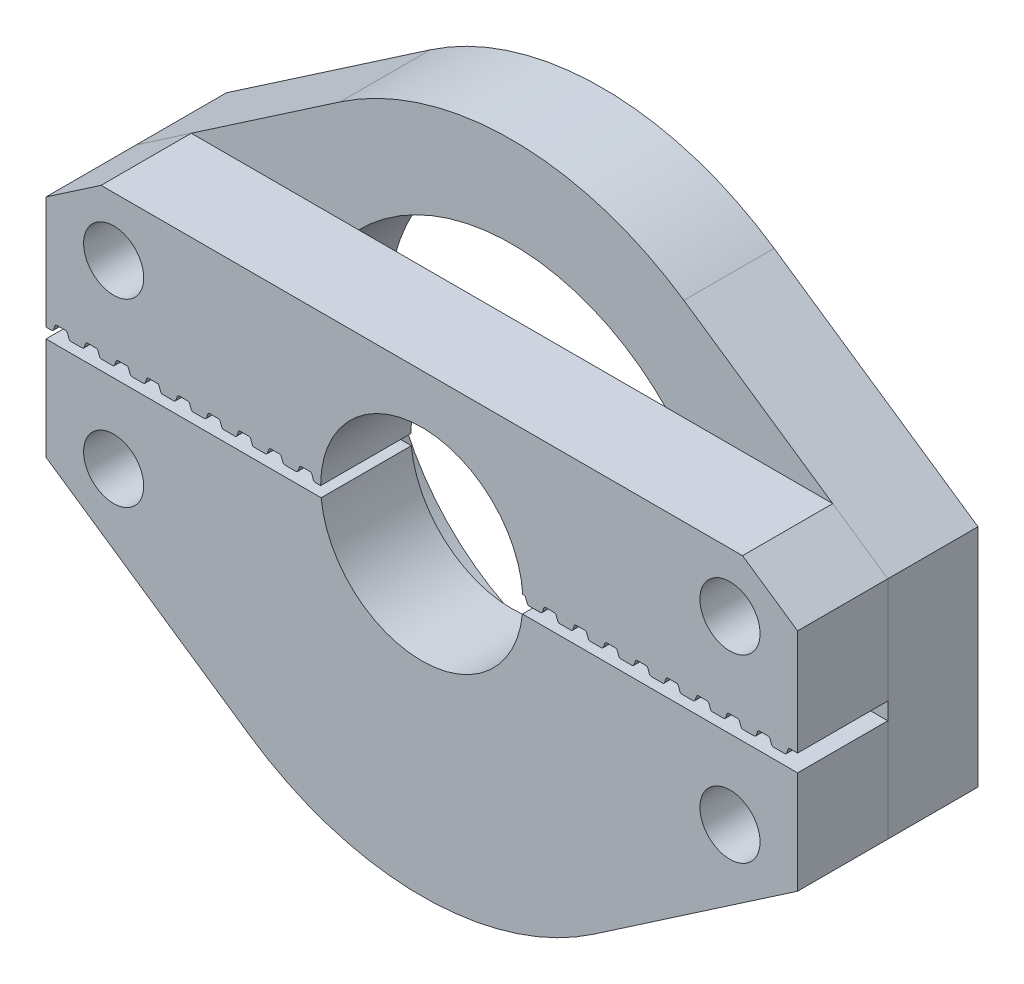
from build123d import *

# Parameters (mm, degrees)
SKETCH1_R        = 14.2875
EXTRUDE1_DEPTH   = 6
EXTRUDE2_DEPTH   = 6
EXTRUDE2_2_DEPTH = 6
SKETCH3_R        = 2
EXTRUDE3_DEPTH   = 35.359607918
SKETCH4_R        = 6.731
EXTRUDE4_DEPTH   = 10


with BuildPart() as part:
    # Sketch1 → Extrude1 (new body)
    with BuildSketch(Plane.XY):
        with BuildLine():
            Line((-25, 7.5), (-25, -7.5))
            Line((-25, -7.5), (-11.436219826, -16.756954745))
            ThreePointArc((-11.436219826, -16.756954745), (0, -20.2875), (11.436219826, -16.756954745))
            Line((11.436219826, -16.756954745), (25, -7.5))
            Line((25, -7.5), (25, 7.5))
            Line((25, 7.5), (11.436219826, 16.756954745))
            ThreePointArc((11.436219826, 16.756954745), (0, 20.2875), (-11.436219826, 16.756954745))
            Line((-11.436219826, 16.756954745), (-25, 7.5))
        make_face()
        Circle(SKETCH1_R, mode=Mode.SUBTRACT)
    extrude(amount=EXTRUDE1_DEPTH)


with BuildPart() as body_2:
    # Sketch2 → Extrude2 (new body)
    with BuildSketch(Plane.XY.offset(6)):
        with BuildLine():
            Line((-25, -0.68), (25, -0.68))
            Line((25, -0.68), (25, -7.5))
            Line((25, -7.5), (11.436219826, -16.756954745))
            ThreePointArc((11.436219826, -16.756954745), (0, -20.2875), (-11.436219826, -16.756954745))
            Line((-11.436219826, -16.756954745), (-25, -7.5))
            Line((-25, -7.5), (-25, -0.68))
        make_face()
    extrude(amount=EXTRUDE2_DEPTH)


with BuildPart() as body_3:
    # Sketch2 → Extrude2 2 (new body)
    with BuildSketch(Plane.XY.offset(6)):
        with BuildLine():
            Line((25, 7.5), (21.336867645, 10))
            Line((21.336867645, 10), (-21.336867645, 10))
            Line((-21.336867645, 10), (-25, 7.5))
            Line((-25, 7.5), (-25, 0))
            Line((-25, 0), (-24.622453288, 0))
            ThreePointArc((-24.622453288, 0), (-24.547888351, 0.023510234), (-24.500293247, 0.085537381))
            Line((-24.500293247, 0.085537381), (-24.395133061, 0.374462619))
            ThreePointArc((-24.395133061, 0.374462619), (-24.347537957, 0.436489766), (-24.27297302, 0.46))
            Line((-24.27297302, 0.46), (-23.69502698, 0.46))
            ThreePointArc((-23.69502698, 0.46), (-23.620462043, 0.436489766), (-23.572866939, 0.374462619))
            Line((-23.572866939, 0.374462619), (-23.467706753, 0.085537381))
            ThreePointArc((-23.467706753, 0.085537381), (-23.420111649, 0.023510234), (-23.345546712, 0))
            Line((-23.345546712, 0), (-22.968, 0))
            Line((-22.968, 0), (-22.590453288, 0))
            ThreePointArc((-22.590453288, 0), (-22.515888351, 0.023510234), (-22.468293247, 0.085537381))
            Line((-22.468293247, 0.085537381), (-22.363133061, 0.374462619))
            ThreePointArc((-22.363133061, 0.374462619), (-22.315537957, 0.436489766), (-22.24097302, 0.46))
            Line((-22.24097302, 0.46), (-21.66302698, 0.46))
            ThreePointArc((-21.66302698, 0.46), (-21.588462043, 0.436489766), (-21.540866939, 0.374462619))
            Line((-21.540866939, 0.374462619), (-21.435706753, 0.085537381))
            ThreePointArc((-21.435706753, 0.085537381), (-21.388111649, 0.023510234), (-21.313546712, 0))
            Line((-21.313546712, 0), (-20.936, 0))
            Line((-20.936, 0), (-20.558453288, 0))
            ThreePointArc((-20.558453288, 0), (-20.483888351, 0.023510234), (-20.436293247, 0.085537381))
            Line((-20.436293247, 0.085537381), (-20.331133061, 0.374462619))
            ThreePointArc((-20.331133061, 0.374462619), (-20.283537957, 0.436489766), (-20.20897302, 0.46))
            Line((-20.20897302, 0.46), (-19.63102698, 0.46))
            ThreePointArc((-19.63102698, 0.46), (-19.556462043, 0.436489766), (-19.508866939, 0.374462619))
            Line((-19.508866939, 0.374462619), (-19.403706753, 0.085537381))
            ThreePointArc((-19.403706753, 0.085537381), (-19.356111649, 0.023510234), (-19.281546712, 0))
            Line((-19.281546712, 0), (-18.904, 0))
            Line((-18.904, 0), (-18.526453288, 0))
            ThreePointArc((-18.526453288, 0), (-18.451888351, 0.023510234), (-18.404293247, 0.085537381))
            Line((-18.404293247, 0.085537381), (-18.299133061, 0.374462619))
            ThreePointArc((-18.299133061, 0.374462619), (-18.251537957, 0.436489766), (-18.17697302, 0.46))
            Line((-18.17697302, 0.46), (-17.59902698, 0.46))
            ThreePointArc((-17.59902698, 0.46), (-17.524462043, 0.436489766), (-17.476866939, 0.374462619))
            Line((-17.476866939, 0.374462619), (-17.371706753, 0.085537381))
            ThreePointArc((-17.371706753, 0.085537381), (-17.324111649, 0.023510234), (-17.249546712, 0))
            Line((-17.249546712, 0), (-16.872, 0))
            Line((-16.872, 0), (-16.494453288, 0))
            ThreePointArc((-16.494453288, 0), (-16.419888351, 0.023510234), (-16.372293247, 0.085537381))
            Line((-16.372293247, 0.085537381), (-16.267133061, 0.374462619))
            ThreePointArc((-16.267133061, 0.374462619), (-16.219537957, 0.436489766), (-16.14497302, 0.46))
            Line((-16.14497302, 0.46), (-15.56702698, 0.46))
            ThreePointArc((-15.56702698, 0.46), (-15.492462043, 0.436489766), (-15.444866939, 0.374462619))
            Line((-15.444866939, 0.374462619), (-15.339706753, 0.085537381))
            ThreePointArc((-15.339706753, 0.085537381), (-15.292111649, 0.023510234), (-15.217546712, 0))
            Line((-15.217546712, 0), (-14.84, 0))
            Line((-14.84, 0), (-14.462453288, 0))
            ThreePointArc((-14.462453288, 0), (-14.387888351, 0.023510234), (-14.340293247, 0.085537381))
            Line((-14.340293247, 0.085537381), (-14.235133061, 0.374462619))
            ThreePointArc((-14.235133061, 0.374462619), (-14.187537957, 0.436489766), (-14.11297302, 0.46))
            Line((-14.11297302, 0.46), (-13.53502698, 0.46))
            ThreePointArc((-13.53502698, 0.46), (-13.460462043, 0.436489766), (-13.412866939, 0.374462619))
            Line((-13.412866939, 0.374462619), (-13.307706753, 0.085537381))
            ThreePointArc((-13.307706753, 0.085537381), (-13.260111649, 0.023510234), (-13.185546712, 0))
            Line((-13.185546712, 0), (-12.808, 0))
            Line((-12.808, 0), (-12.430453288, 0))
            ThreePointArc((-12.430453288, 0), (-12.355888351, 0.023510234), (-12.308293247, 0.085537381))
            Line((-12.308293247, 0.085537381), (-12.203133061, 0.374462619))
            ThreePointArc((-12.203133061, 0.374462619), (-12.155537957, 0.436489766), (-12.08097302, 0.46))
            Line((-12.08097302, 0.46), (-11.50302698, 0.46))
            ThreePointArc((-11.50302698, 0.46), (-11.428462043, 0.436489766), (-11.380866939, 0.374462619))
            Line((-11.380866939, 0.374462619), (-11.275706753, 0.085537381))
            ThreePointArc((-11.275706753, 0.085537381), (-11.228111649, 0.023510234), (-11.153546712, 0))
            Line((-11.153546712, 0), (-10.776, 0))
            Line((-10.776, 0), (-10.398453288, 0))
            ThreePointArc((-10.398453288, 0), (-10.323888351, 0.023510234), (-10.276293247, 0.085537381))
            Line((-10.276293247, 0.085537381), (-10.171133061, 0.374462619))
            ThreePointArc((-10.171133061, 0.374462619), (-10.123537957, 0.436489766), (-10.04897302, 0.46))
            Line((-10.04897302, 0.46), (-9.47102698, 0.46))
            ThreePointArc((-9.47102698, 0.46), (-9.396462043, 0.436489766), (-9.348866939, 0.374462619))
            Line((-9.348866939, 0.374462619), (-9.243706753, 0.085537381))
            ThreePointArc((-9.243706753, 0.085537381), (-9.196111649, 0.023510234), (-9.121546712, 0))
            Line((-9.121546712, 0), (-8.744, 0))
            Line((-8.744, 0), (-8.366453288, 0))
            ThreePointArc((-8.366453288, 0), (-8.291888351, 0.023510234), (-8.244293247, 0.085537381))
            Line((-8.244293247, 0.085537381), (-8.139133061, 0.374462619))
            ThreePointArc((-8.139133061, 0.374462619), (-8.091537957, 0.436489766), (-8.01697302, 0.46))
            Line((-8.01697302, 0.46), (-7.43902698, 0.46))
            ThreePointArc((-7.43902698, 0.46), (-7.364462043, 0.436489766), (-7.316866939, 0.374462619))
            Line((-7.316866939, 0.374462619), (-7.211706753, 0.085537381))
            ThreePointArc((-7.211706753, 0.085537381), (-7.164111649, 0.023510234), (-7.089546712, 0))
            Line((-7.089546712, 0), (-6.712, 0))
            Line((-6.712, 0), (-6.334453288, 0))
            ThreePointArc((-6.334453288, 0), (-6.259888351, 0.023510234), (-6.212293247, 0.085537381))
            Line((-6.212293247, 0.085537381), (-6.107133061, 0.374462619))
            ThreePointArc((-6.107133061, 0.374462619), (-6.059537957, 0.436489766), (-5.98497302, 0.46))
            Line((-5.98497302, 0.46), (-5.40702698, 0.46))
            ThreePointArc((-5.40702698, 0.46), (-5.332462043, 0.436489766), (-5.284866939, 0.374462619))
            Line((-5.284866939, 0.374462619), (-5.179706753, 0.085537381))
            ThreePointArc((-5.179706753, 0.085537381), (-5.132111649, 0.023510234), (-5.057546712, 0))
            Line((-5.057546712, 0), (-4.68, 0))
            Line((-4.68, 0), (-4.302453288, 0))
            ThreePointArc((-4.302453288, 0), (-4.227888351, 0.023510234), (-4.180293247, 0.085537381))
            Line((-4.180293247, 0.085537381), (-4.075133061, 0.374462619))
            ThreePointArc((-4.075133061, 0.374462619), (-4.027537957, 0.436489766), (-3.95297302, 0.46))
            Line((-3.95297302, 0.46), (-3.37502698, 0.46))
            ThreePointArc((-3.37502698, 0.46), (-3.300462043, 0.436489766), (-3.252866939, 0.374462619))
            Line((-3.252866939, 0.374462619), (-3.147706753, 0.085537381))
            ThreePointArc((-3.147706753, 0.085537381), (-3.100111649, 0.023510234), (-3.025546712, 0))
            Line((-3.025546712, 0), (-2.648, 0))
            Line((-2.648, 0), (-2.270453288, 0))
            ThreePointArc((-2.270453288, 0), (-2.195888351, 0.023510234), (-2.148293247, 0.085537381))
            Line((-2.148293247, 0.085537381), (-2.043133061, 0.374462619))
            ThreePointArc((-2.043133061, 0.374462619), (-1.995537957, 0.436489766), (-1.92097302, 0.46))
            Line((-1.92097302, 0.46), (-1.34302698, 0.46))
            ThreePointArc((-1.34302698, 0.46), (-1.268462043, 0.436489766), (-1.220866939, 0.374462619))
            Line((-1.220866939, 0.374462619), (-1.115706753, 0.085537381))
            ThreePointArc((-1.115706753, 0.085537381), (-1.068111649, 0.023510234), (-0.993546712, 0))
            Line((-0.993546712, 0), (-0.616, 0))
            Line((-0.616, 0), (-0.238453288, 0))
            ThreePointArc((-0.238453288, 0), (-0.163888351, 0.023510234), (-0.116293247, 0.085537381))
            Line((-0.116293247, 0.085537381), (-0.011133061, 0.374462619))
            ThreePointArc((-0.011133061, 0.374462619), (0.036462043, 0.436489766), (0.11102698, 0.46))
            Line((0.11102698, 0.46), (0.68897302, 0.46))
            ThreePointArc((0.68897302, 0.46), (0.763537957, 0.436489766), (0.811133061, 0.374462619))
            Line((0.811133061, 0.374462619), (0.916293247, 0.085537381))
            ThreePointArc((0.916293247, 0.085537381), (0.963888351, 0.023510234), (1.038453288, 0))
            Line((1.038453288, 0), (1.416, 0))
            Line((1.416, 0), (1.793546712, 0))
            ThreePointArc((1.793546712, 0), (1.868111649, 0.023510234), (1.915706753, 0.085537381))
            Line((1.915706753, 0.085537381), (2.020866939, 0.374462619))
            ThreePointArc((2.020866939, 0.374462619), (2.068462043, 0.436489766), (2.14302698, 0.46))
            Line((2.14302698, 0.46), (2.72097302, 0.46))
            ThreePointArc((2.72097302, 0.46), (2.795537957, 0.436489766), (2.843133061, 0.374462619))
            Line((2.843133061, 0.374462619), (2.948293247, 0.085537381))
            ThreePointArc((2.948293247, 0.085537381), (2.995888351, 0.023510234), (3.070453288, 0))
            Line((3.070453288, 0), (3.448, 0))
            Line((3.448, 0), (3.825546712, 0))
            ThreePointArc((3.825546712, 0), (3.900111649, 0.023510234), (3.947706753, 0.085537381))
            Line((3.947706753, 0.085537381), (4.052866939, 0.374462619))
            ThreePointArc((4.052866939, 0.374462619), (4.100462043, 0.436489766), (4.17502698, 0.46))
            Line((4.17502698, 0.46), (4.75297302, 0.46))
            ThreePointArc((4.75297302, 0.46), (4.827537957, 0.436489766), (4.875133061, 0.374462619))
            Line((4.875133061, 0.374462619), (4.980293247, 0.085537381))
            ThreePointArc((4.980293247, 0.085537381), (5.027888351, 0.023510234), (5.102453288, 0))
            Line((5.102453288, 0), (5.48, 0))
            Line((5.48, 0), (5.857546712, 0))
            ThreePointArc((5.857546712, 0), (5.932111649, 0.023510234), (5.979706753, 0.085537381))
            Line((5.979706753, 0.085537381), (6.084866939, 0.374462619))
            ThreePointArc((6.084866939, 0.374462619), (6.132462043, 0.436489766), (6.20702698, 0.46))
            Line((6.20702698, 0.46), (6.78497302, 0.46))
            ThreePointArc((6.78497302, 0.46), (6.859537957, 0.436489766), (6.907133061, 0.374462619))
            Line((6.907133061, 0.374462619), (7.012293247, 0.085537381))
            ThreePointArc((7.012293247, 0.085537381), (7.059888351, 0.023510234), (7.134453288, 0))
            Line((7.134453288, 0), (7.512, 0))
            Line((7.512, 0), (7.889546712, 0))
            ThreePointArc((7.889546712, 0), (7.964111649, 0.023510234), (8.011706753, 0.085537381))
            Line((8.011706753, 0.085537381), (8.116866939, 0.374462619))
            ThreePointArc((8.116866939, 0.374462619), (8.164462043, 0.436489766), (8.23902698, 0.46))
            Line((8.23902698, 0.46), (8.81697302, 0.46))
            ThreePointArc((8.81697302, 0.46), (8.891537957, 0.436489766), (8.939133061, 0.374462619))
            Line((8.939133061, 0.374462619), (9.044293247, 0.085537381))
            ThreePointArc((9.044293247, 0.085537381), (9.091888351, 0.023510234), (9.166453288, 0))
            Line((9.166453288, 0), (9.544, 0))
            Line((9.544, 0), (9.921546712, 0))
            ThreePointArc((9.921546712, 0), (9.996111649, 0.023510234), (10.043706753, 0.085537381))
            Line((10.043706753, 0.085537381), (10.148866939, 0.374462619))
            ThreePointArc((10.148866939, 0.374462619), (10.196462043, 0.436489766), (10.27102698, 0.46))
            Line((10.27102698, 0.46), (10.84897302, 0.46))
            ThreePointArc((10.84897302, 0.46), (10.923537957, 0.436489766), (10.971133061, 0.374462619))
            Line((10.971133061, 0.374462619), (11.076293247, 0.085537381))
            ThreePointArc((11.076293247, 0.085537381), (11.123888351, 0.023510234), (11.198453288, 0))
            Line((11.198453288, 0), (11.576, 0))
            Line((11.576, 0), (11.953546712, 0))
            ThreePointArc((11.953546712, 0), (12.028111649, 0.023510234), (12.075706753, 0.085537381))
            Line((12.075706753, 0.085537381), (12.180866939, 0.374462619))
            ThreePointArc((12.180866939, 0.374462619), (12.228462043, 0.436489766), (12.30302698, 0.46))
            Line((12.30302698, 0.46), (12.88097302, 0.46))
            ThreePointArc((12.88097302, 0.46), (12.955537957, 0.436489766), (13.003133061, 0.374462619))
            Line((13.003133061, 0.374462619), (13.108293247, 0.085537381))
            ThreePointArc((13.108293247, 0.085537381), (13.155888351, 0.023510234), (13.230453288, 0))
            Line((13.230453288, 0), (13.608, 0))
            Line((13.608, 0), (13.985546712, 0))
            ThreePointArc((13.985546712, 0), (14.060111649, 0.023510234), (14.107706753, 0.085537381))
            Line((14.107706753, 0.085537381), (14.212866939, 0.374462619))
            ThreePointArc((14.212866939, 0.374462619), (14.260462043, 0.436489766), (14.33502698, 0.46))
            Line((14.33502698, 0.46), (14.91297302, 0.46))
            ThreePointArc((14.91297302, 0.46), (14.987537957, 0.436489766), (15.035133061, 0.374462619))
            Line((15.035133061, 0.374462619), (15.140293247, 0.085537381))
            ThreePointArc((15.140293247, 0.085537381), (15.187888351, 0.023510234), (15.262453288, 0))
            Line((15.262453288, 0), (15.64, 0))
            Line((15.64, 0), (16.017546712, 0))
            ThreePointArc((16.017546712, 0), (16.092111649, 0.023510234), (16.139706753, 0.085537381))
            Line((16.139706753, 0.085537381), (16.244866939, 0.374462619))
            ThreePointArc((16.244866939, 0.374462619), (16.292462043, 0.436489766), (16.36702698, 0.46))
            Line((16.36702698, 0.46), (16.94497302, 0.46))
            ThreePointArc((16.94497302, 0.46), (17.019537957, 0.436489766), (17.067133061, 0.374462619))
            Line((17.067133061, 0.374462619), (17.172293247, 0.085537381))
            ThreePointArc((17.172293247, 0.085537381), (17.219888351, 0.023510234), (17.294453288, 0))
            Line((17.294453288, 0), (17.672, 0))
            Line((17.672, 0), (18.049546712, 0))
            ThreePointArc((18.049546712, 0), (18.124111649, 0.023510234), (18.171706753, 0.085537381))
            Line((18.171706753, 0.085537381), (18.276866939, 0.374462619))
            ThreePointArc((18.276866939, 0.374462619), (18.324462043, 0.436489766), (18.39902698, 0.46))
            Line((18.39902698, 0.46), (18.97697302, 0.46))
            ThreePointArc((18.97697302, 0.46), (19.051537957, 0.436489766), (19.099133061, 0.374462619))
            Line((19.099133061, 0.374462619), (19.204293247, 0.085537381))
            ThreePointArc((19.204293247, 0.085537381), (19.251888351, 0.023510234), (19.326453288, 0))
            Line((19.326453288, 0), (19.704, 0))
            Line((19.704, 0), (20.081546712, 0))
            ThreePointArc((20.081546712, 0), (20.156111649, 0.023510234), (20.203706753, 0.085537381))
            Line((20.203706753, 0.085537381), (20.308866939, 0.374462619))
            ThreePointArc((20.308866939, 0.374462619), (20.356462043, 0.436489766), (20.43102698, 0.46))
            Line((20.43102698, 0.46), (21.00897302, 0.46))
            ThreePointArc((21.00897302, 0.46), (21.083537957, 0.436489766), (21.131133061, 0.374462619))
            Line((21.131133061, 0.374462619), (21.236293247, 0.085537381))
            ThreePointArc((21.236293247, 0.085537381), (21.283888351, 0.023510234), (21.358453288, 0))
            Line((21.358453288, 0), (21.736, 0))
            Line((21.736, 0), (22.113546712, 0))
            ThreePointArc((22.113546712, 0), (22.188111649, 0.023510234), (22.235706753, 0.085537381))
            Line((22.235706753, 0.085537381), (22.340866939, 0.374462619))
            ThreePointArc((22.340866939, 0.374462619), (22.388462043, 0.436489766), (22.46302698, 0.46))
            Line((22.46302698, 0.46), (23.04097302, 0.46))
            ThreePointArc((23.04097302, 0.46), (23.115537957, 0.436489766), (23.163133061, 0.374462619))
            Line((23.163133061, 0.374462619), (23.268293247, 0.085537381))
            ThreePointArc((23.268293247, 0.085537381), (23.315888351, 0.023510234), (23.390453288, 0))
            Line((23.390453288, 0), (23.768, 0))
            Line((23.768, 0), (24.145546712, 0))
            ThreePointArc((24.145546712, 0), (24.220111649, 0.023510234), (24.267706753, 0.085537381))
            Line((24.267706753, 0.085537381), (24.372866939, 0.374462619))
            ThreePointArc((24.372866939, 0.374462619), (24.420462043, 0.436489766), (24.49502698, 0.46))
            Line((24.49502698, 0.46), (25, 0.46))
            Line((25, 0.46), (25, 7.5))
        make_face()
    extrude(amount=EXTRUDE2_2_DEPTH)


with BuildPart() as extrude3_tool:
    # Sketch3 → Extrude3 (new, through all)
    with BuildSketch(Plane.XY.offset(12)):
        with Locations((-20.5, 6.085537381)):
            Circle(SKETCH3_R)
        with Locations((-20.5, -5.914462619)):
            Circle(SKETCH3_R)
        with Locations((20.5, -5.914462619)):
            Circle(SKETCH3_R)
        with Locations((20.5, 6.085537381)):
            Circle(SKETCH3_R)
    extrude(amount=-EXTRUDE3_DEPTH)


with BuildPart() as part_1:
    add(part.part)

    # Extrude3: cut by extrude3_tool
    add(extrude3_tool.part, mode=Mode.SUBTRACT)


with BuildPart() as body_2_1:
    add(body_2.part)

    # Extrude3: cut by extrude3_tool
    add(extrude3_tool.part, mode=Mode.SUBTRACT)


with BuildPart() as body_3_1:
    add(body_3.part)

    # Extrude3: cut by extrude3_tool
    add(extrude3_tool.part, mode=Mode.SUBTRACT)


with BuildPart() as extrude4_tool:
    # Sketch4 → Extrude4 (new body)
    with BuildSketch(Plane(origin=(0, 0, 6), x_dir=(-1, 0, 0), z_dir=(0, 0, -1))):
        Circle(SKETCH4_R)
    extrude(amount=-EXTRUDE4_DEPTH)


with BuildPart() as body_2_2:
    add(body_2_1.part)

    # Extrude4: cut by extrude4_tool
    add(extrude4_tool.part, mode=Mode.SUBTRACT)


with BuildPart() as body_3_2:
    add(body_3_1.part)

    # Extrude4: cut by extrude4_tool
    add(extrude4_tool.part, mode=Mode.SUBTRACT)


solid = Compound([part_1.part, body_2_2.part, body_3_2.part])
